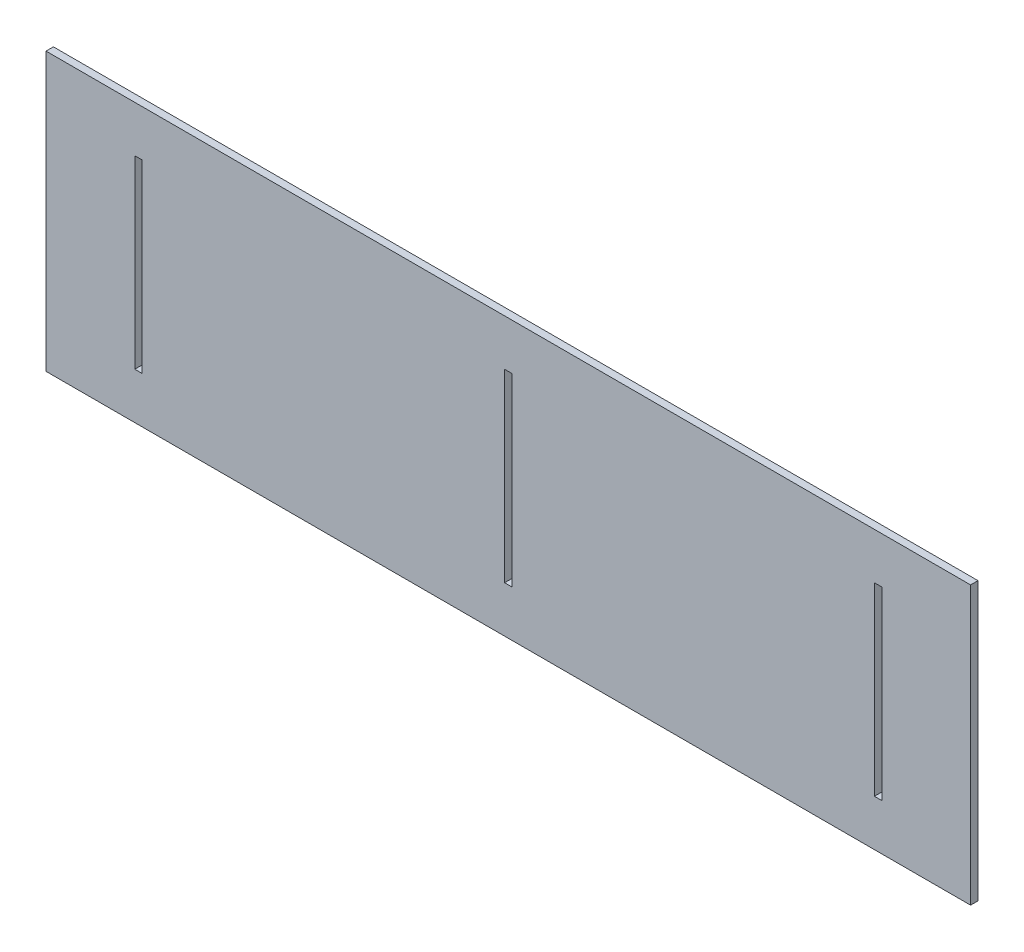
from build123d import *

# Parameters (mm, degrees)
SKETCH_2_W               = 250
SKETCH_2_H               = 75
EXTRUDE_3_DEPTH          = 2
CUT_EXTRUDE_1_DEPTH      = 2
CUT_EXTRUDE_1_DEPTH_BACK = 2
SKETCH_4_W               = 2
SKETCH_4_H               = 50


with BuildPart() as part:
    # 草图2 → 凸台-拉伸3 (new body)
    with BuildSketch(Plane.XY):
        with Locations((51.318241286, 40.884671024)):
            Rectangle(SKETCH_2_W, SKETCH_2_H)
    extrude(amount=EXTRUDE_3_DEPTH)

    # 草图4 → 切除-拉伸1 (cut, two sides: drawn at the far end of the back side and taken through both)
    with BuildSketch(Plane.XY.offset(-CUT_EXTRUDE_1_DEPTH_BACK)):
        with Locations((151.318241286, 40.884671024)):
            Rectangle(SKETCH_4_W, SKETCH_4_H)
        with Locations((-48.681758714, 40.884671024)):
            Rectangle(SKETCH_4_W, SKETCH_4_H)
        with Locations((51.318241286, 40.884671024)):
            Rectangle(SKETCH_4_W, SKETCH_4_H)
    extrude(amount=CUT_EXTRUDE_1_DEPTH + CUT_EXTRUDE_1_DEPTH_BACK, mode=Mode.SUBTRACT)


solid = part.part
